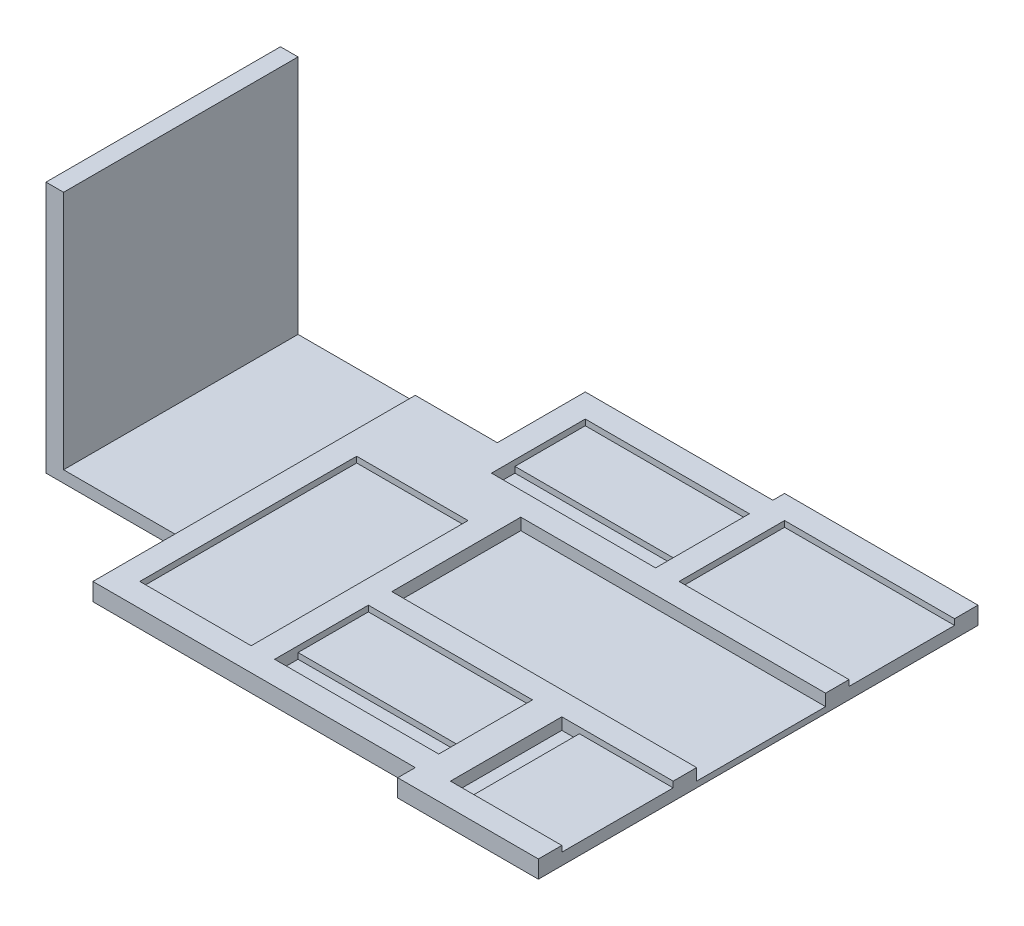
from build123d import *

# Parameters (mm, degrees)
BOSS_EXTRUDE2_DEPTH = 3
MOD_BAT_W           = 29
MOD_BAT_H           = 18
CUT_MOD_BAT_DEPTH   = 1
PICO_W              = 52
PICO_H              = 22
CUT_PICO_DEPTH      = 2
SD_CARD_W           = 19
SD_CARD_H           = 19
CUT_SD_CARD_DEPTH   = 1
SD_PIN_W            = 3
SD_PIN_H            = 19
CUT_SD_PIN_DEPTH    = 2
ACELEROMETRO1_W     = 28
ACELEROMETRO1_H     = 16
CUT_ACL1_DEPTH      = 1
STEP_UP_W           = 19
STEP_UP_H           = 37
CUT_STEPUP_DEPTH    = 1
ACELEROMETRO2_W     = 28
ACELEROMETRO2_H     = 16
CUT_ACL2_DEPTH      = 1
SKETCH10_W          = 28
SKETCH10_H          = 4
CUT_ACL1_PIN_DEPTH  = 2
SKETCH10_3_W        = 28
SKETCH10_3_H        = 4
CUT_ACL2_PIN_DEPTH  = 2
SKETCH11_W          = 3
SKETCH11_H          = 40
BOSS_EXTRUDE3_DEPTH = 40
SKETCH12_W          = 20
SKETCH12_H          = 40
CUT_EXTRUDE15_DEPTH = 1


with BuildPart() as part:
    # Sketch7 → Boss-Extrude2 (new body)
    with BuildSketch(Plane(origin=(0, 0, 0), x_dir=(1, 0, 0), z_dir=(0, 1, 0))):
        Polygon((-65, 20), (-102, 20), (-102, -20), (-79, -20), (-79, -35), (-24, -35), (-24, -38), (0, -38), (0, 37), (-33, 37), (-33, 35), (-65, 35), align=None)
    extrude(amount=-BOSS_EXTRUDE2_DEPTH)

    # Mod. Bat → Cut-mod Bat (cut)
    with BuildSketch(Plane(origin=(0, 0, 0), x_dir=(1, 0, 0), z_dir=(0, 1, 0))):
        with Locations((-14.5, 24)):
            Rectangle(MOD_BAT_W, MOD_BAT_H)
    extrude(amount=-CUT_MOD_BAT_DEPTH, mode=Mode.SUBTRACT)

    # Pico → Cut-Pico (cut)
    with BuildSketch(Plane(origin=(0, 0, 0), x_dir=(1, 0, 0), z_dir=(0, 1, 0))):
        with Locations((-26, 0)):
            Rectangle(PICO_W, PICO_H)
    extrude(amount=-CUT_PICO_DEPTH, mode=Mode.SUBTRACT)

    # SD Card → Cut-SD Card (cut)
    with BuildSketch(Plane(origin=(0, 0, 0), x_dir=(1, 0, 0), z_dir=(0, 1, 0))):
        with Locations((-9.5, -24.5)):
            Rectangle(SD_CARD_W, SD_CARD_H)
    extrude(amount=-CUT_SD_CARD_DEPTH, mode=Mode.SUBTRACT)

    # SD Pin → Cut-SD Pin (cut)
    with BuildSketch(Plane(origin=(0, 0, 0), x_dir=(1, 0, 0), z_dir=(0, 1, 0))):
        with Locations((-17.5, -24.5)):
            Rectangle(SD_PIN_W, SD_PIN_H)
    extrude(amount=-CUT_SD_PIN_DEPTH, mode=Mode.SUBTRACT)

    # Acelerometro1 → Cut-Acl1 (cut)
    with BuildSketch(Plane(origin=(0, 0, 0), x_dir=(1, 0, 0), z_dir=(0, 1, 0))):
        with Locations((-38, -23)):
            Rectangle(ACELEROMETRO1_W, ACELEROMETRO1_H)
    extrude(amount=-CUT_ACL1_DEPTH, mode=Mode.SUBTRACT)

    # step-up → Cut-StepUp (cut)
    with BuildSketch(Plane(origin=(0, 0, 0), x_dir=(1, 0, 0), z_dir=(0, 1, 0))):
        with Locations((-65.5, -12.5)):
            Rectangle(STEP_UP_W, STEP_UP_H)
    extrude(amount=-CUT_STEPUP_DEPTH, mode=Mode.SUBTRACT)

    # Acelerometro2 → Cut-Acl2 (cut)
    with BuildSketch(Plane(origin=(0, 0, 0), x_dir=(1, 0, 0), z_dir=(0, 1, 0))):
        with Locations((-47, 23)):
            Rectangle(ACELEROMETRO2_W, ACELEROMETRO2_H)
    extrude(amount=-CUT_ACL2_DEPTH, mode=Mode.SUBTRACT)

    # Sketch10 → Cut-Acl1 Pin (cut)
    with BuildSketch(Plane(origin=(0, 0, 0), x_dir=(1, 0, 0), z_dir=(0, 1, 0))):
        with Locations((-47, 17)):
            Rectangle(SKETCH10_W, SKETCH10_H)
    extrude(amount=-CUT_ACL1_PIN_DEPTH, mode=Mode.SUBTRACT)

    # Sketch10<3> → Cut-Acl2 Pin (cut)
    with BuildSketch(Plane(origin=(0, 0, 0), x_dir=(1, 0, 0), z_dir=(0, 1, 0))):
        with Locations((-38, -29)):
            Rectangle(SKETCH10_3_W, SKETCH10_3_H)
    extrude(amount=-CUT_ACL2_PIN_DEPTH, mode=Mode.SUBTRACT)

    # Sketch11 → Boss-Extrude3 (add)
    with BuildSketch(Plane(origin=(0, 0, 0), x_dir=(1, 0, 0), z_dir=(0, 1, 0))):
        with Locations((-100.5, 0)):
            Rectangle(SKETCH11_W, SKETCH11_H)
    extrude(amount=BOSS_EXTRUDE3_DEPTH)

    # Sketch12 → Cut-Extrude15 (cut)
    with BuildSketch(Plane(origin=(0, 0, 0), x_dir=(1, 0, 0), z_dir=(0, 1, 0))):
        with Locations((-89, 0)):
            Rectangle(SKETCH12_W, SKETCH12_H)
    extrude(amount=-CUT_EXTRUDE15_DEPTH, mode=Mode.SUBTRACT)


solid = part.part
